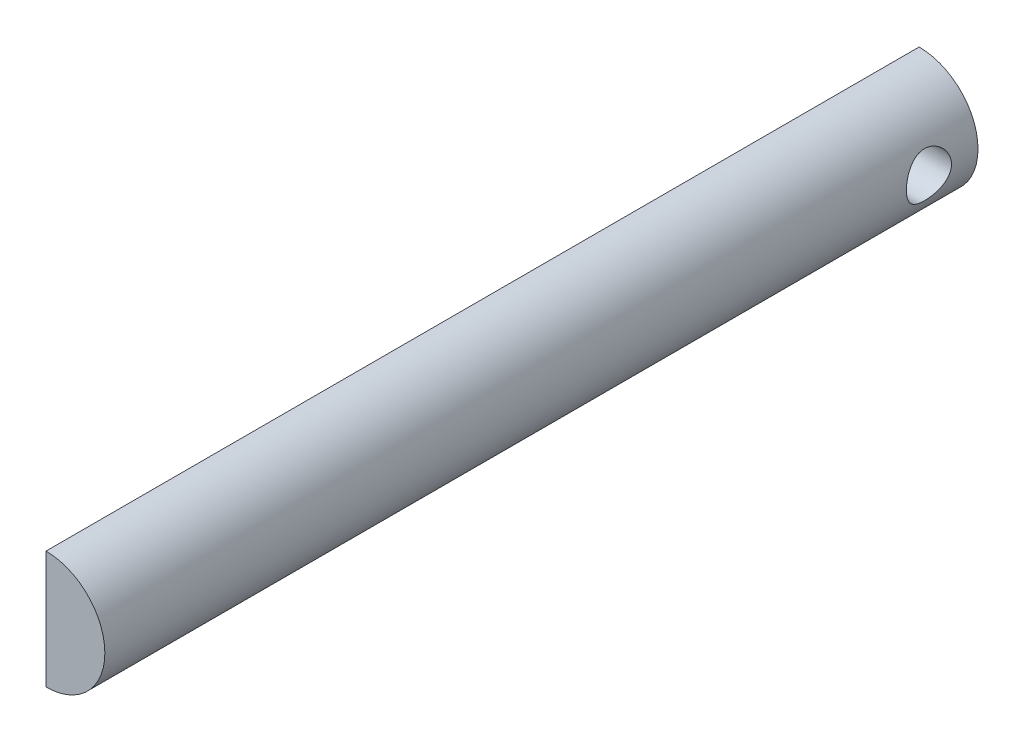
from build123d import *

# Parameters (mm, degrees)
BOSS_EXTRU_1_DEPTH              = 44.5
DIAM_TRE_DU_PER_AGE_2_3_2_3_2_D = 2.3


with BuildPart() as part:
    # Esquisse2 → Boss.-Extru.1 (new body)
    with BuildSketch(Plane.XY):
        with BuildLine():
            Line((0, 3), (0, -3))
            ThreePointArc((0, -3), (3, 0), (0, 3))
        make_face()
    extrude(amount=BOSS_EXTRU_1_DEPTH)

    # Diamètre du perçage Ø2.3 (2.3)2 (through all)
    with Locations(Plane.ZY):
        with Locations((2.5, 0)):
            Hole(DIAM_TRE_DU_PER_AGE_2_3_2_3_2_D / 2)


solid = part.part
